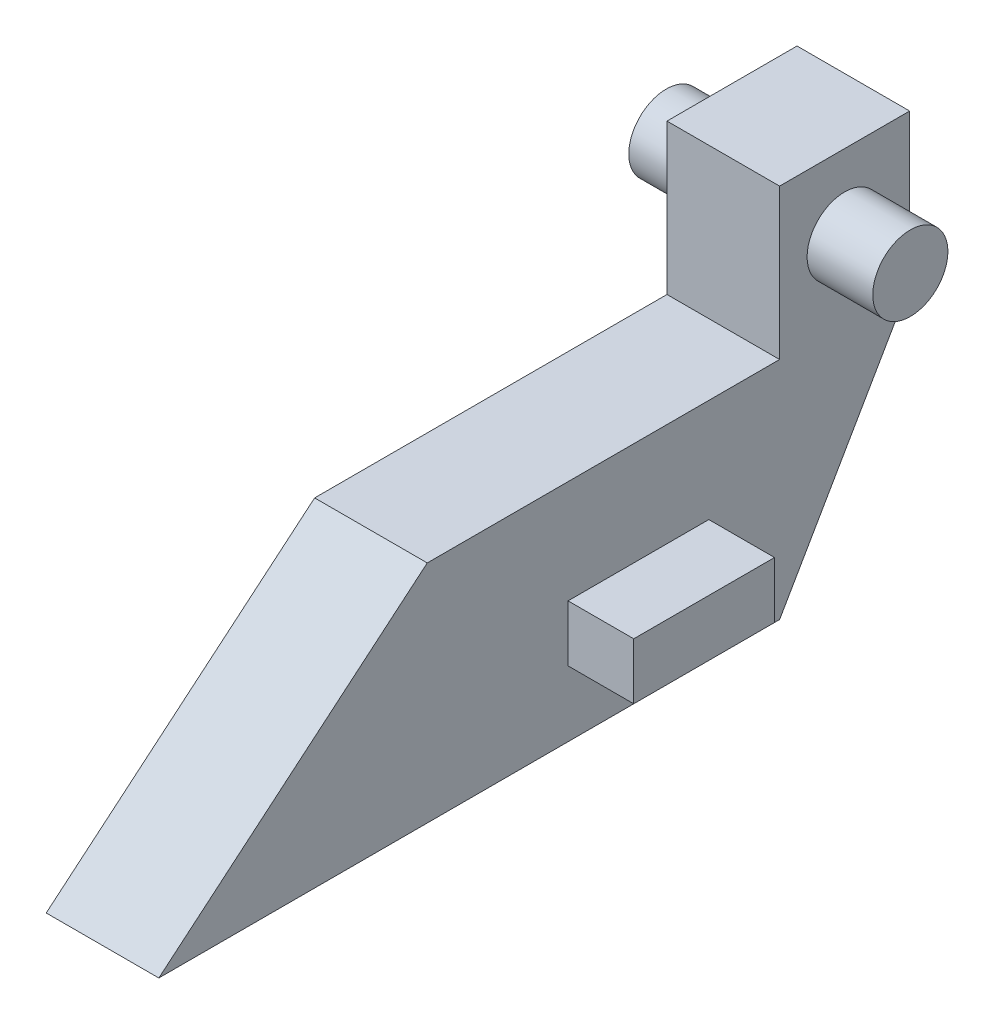
from build123d import *

# Parameters (mm, degrees)
SKETCH1_W           = 12
SKETCH1_H           = 24
BOSS_EXTRUDE1_DEPTH = 80
CUT_EXTRUDE1_DEPTH  = 52
SKETCH3_W           = 15
SKETCH3_H           = 6
BOSS_EXTRUDE2_DEPTH = 7
SKETCH4_W           = 12
SKETCH4_H           = 13.856406461
BOSS_EXTRUDE3_DEPTH = 16
SKETCH6_R           = 4
BOSS_EXTRUDE4_DEPTH = 13


with BuildPart() as part:
    # Sketch1 → Boss-Extrude1 (new body)
    with BuildSketch(Plane.XY):
        with Locations((0, 12)):
            Rectangle(SKETCH1_W, SKETCH1_H)
    extrude(amount=-BOSS_EXTRUDE1_DEPTH)

    # Sketch2 → Cut-Extrude1 (cut)
    with BuildSketch(Plane(origin=(6, 0, 0), x_dir=(0, 0, -1), z_dir=(1, 0, 0))):
        Polygon((0, 24), (0, 0), (28.602086222, 24), align=None)
        Polygon((80, 24), (66.143593539, 0), (80, 0), align=None)
    extrude(amount=-CUT_EXTRUDE1_DEPTH, mode=Mode.SUBTRACT)

    # Sketch3 → Boss-Extrude2 (add)
    with BuildSketch(Plane(origin=(6, 0, 0), x_dir=(0, 0, -1), z_dir=(1, 0, 0))):
        with Locations((51.102086222, 10)):
            Rectangle(SKETCH3_W, SKETCH3_H)
    boss_extrude2 = extrude(amount=BOSS_EXTRUDE2_DEPTH)

    # Mirror1: Boss-Extrude2 across plane
    add(boss_extrude2.mirror(Plane(origin=(0, 0, 0), x_dir=(0, 0, 1), z_dir=(1, 0, 0))))

    # Sketch4 → Boss-Extrude3 (add)
    with BuildSketch(Plane(origin=(0, 24, 0), x_dir=(1, 0, 0), z_dir=(0, 1, 0))):
        with Locations((0, 73.071796769)):
            Rectangle(SKETCH4_W, SKETCH4_H)
    extrude(amount=BOSS_EXTRUDE3_DEPTH)

    # Sketch6 → Boss-Extrude4 (add, symmetric)
    with BuildSketch(Plane(origin=(0, 0, 0), x_dir=(0, 0, -1), z_dir=(1, 0, 0))):
        with Locations(Location((73.07179677, 32, 0), (0, 0, 180))):
            Circle(SKETCH6_R)
    extrude(amount=BOSS_EXTRUDE4_DEPTH, both=True)


solid = part.part
